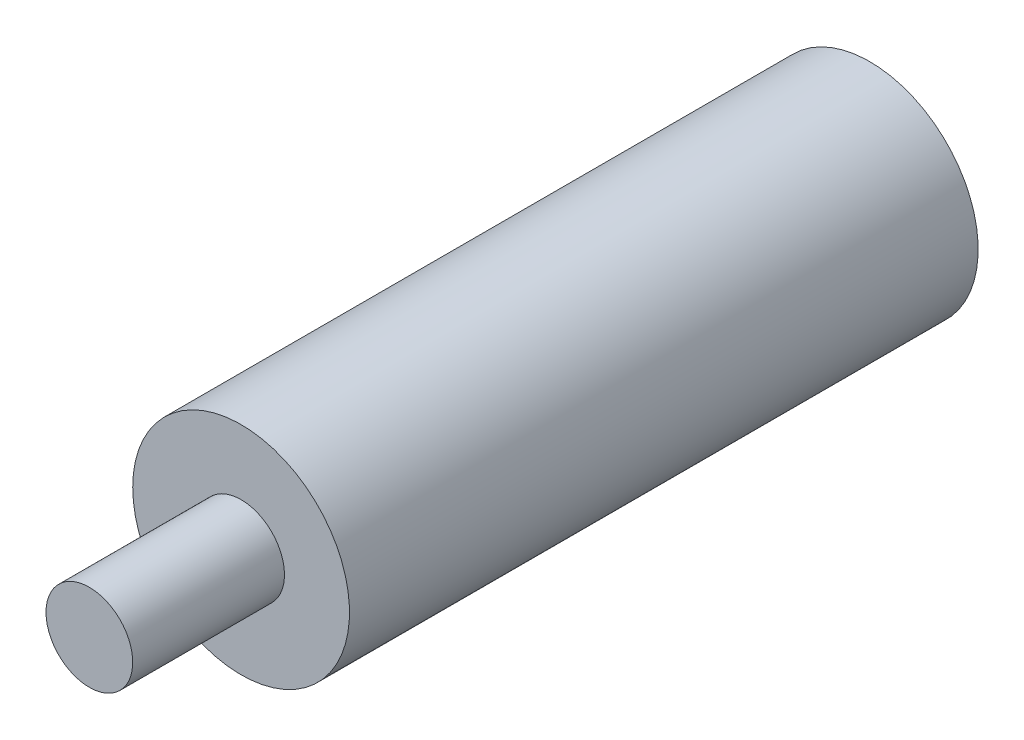
from build123d import *


with BuildPart() as part:
    # Sketch1 → Revolve1 (revolve)
    with BuildSketch(Plane(origin=(0, 0, 0), x_dir=(0, 0, -1), z_dir=(1, 0, 0)), mode=Mode.PRIVATE) as revolve1_sk:
        Polygon((0, 0), (0, 10), (35, 10), (35, 25), (180, 25), (180, 0), align=None)
    revolve(revolve1_sk.sketch.rotate(Axis((0, 0, -145), (0, 0, 1)), 90), axis=Axis((0, 0, -145), (0, 0, 1)))


solid = part.part
